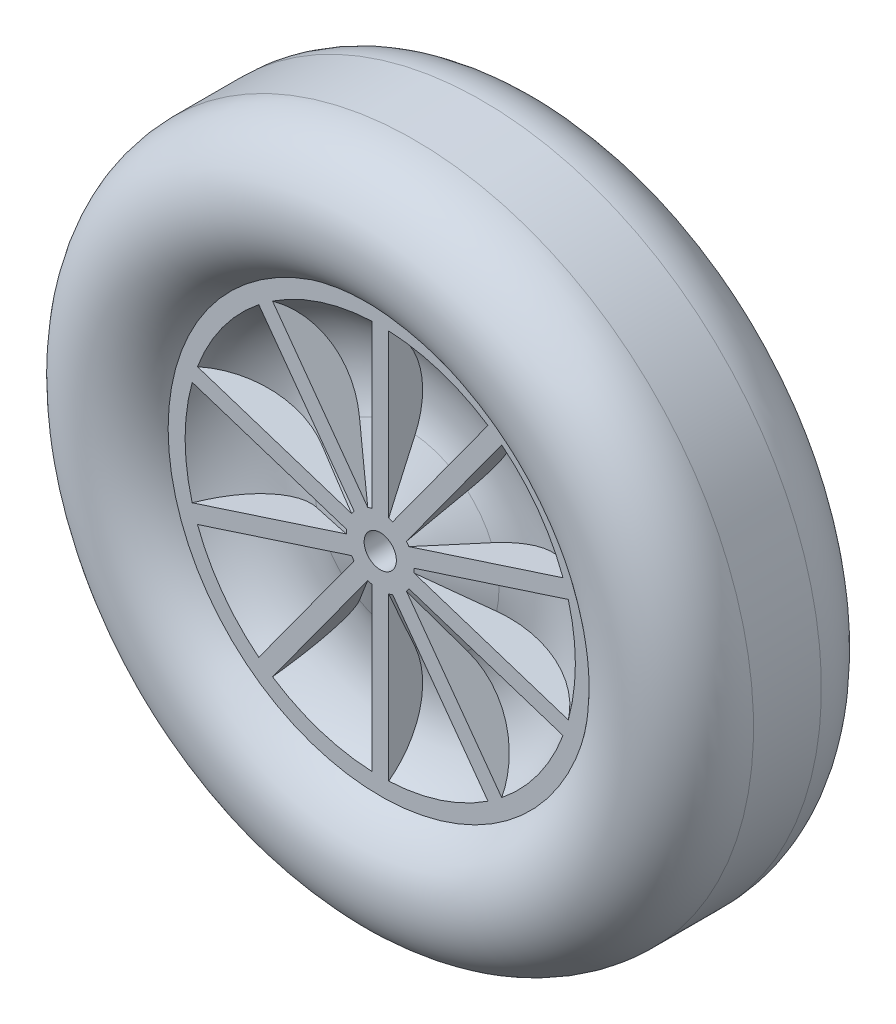
from build123d import *

# Parameters (mm, degrees)
SKETCH8_W           = 10
SKETCH8_H           = 120
BOSS_EXTRUDE1_DEPTH = 40
CIRPATTERN1_COUNT   = 10
SKETCH9_R           = 9.5
CUT_EXTRUDE1_DEPTH  = 301.055596734


with BuildPart() as part:
    # Sketch5 → Revolve1 (revolve)
    with BuildSketch(Plane(origin=(0, 0, 0), x_dir=(0, 0, -1), z_dir=(1, 0, 0)), mode=Mode.PRIVATE) as revolve1_sk:
        with BuildLine():
            Line((-40, 0), (-40, 20))
            Line((-40, 20), (-24.443255163, 54.394588093))
            ThreePointArc((-24.443255163, 54.394588093), (-21.570056673, 87.431435529), (-40, 115))
            Line((-40, 115), (-40, 125))
            Line((-40, 125), (40, 125))
            Line((40, 125), (40, 115))
            ThreePointArc((40, 115), (21.570056673, 87.431435529), (24.443255163, 54.394588093))
            Line((24.443255163, 54.394588093), (40, 20))
            Line((40, 20), (40, 0))
            Line((40, 0), (-40, 0))
        make_face()
    revolve(revolve1_sk.sketch.rotate(Axis((0, 0, -66.183333333), (0, 0, 1)), 90), axis=Axis((0, 0, -66.183333333), (0, 0, 1)))

    # Sketch8 → Boss-Extrude1 (add, symmetric)
    with BuildSketch(Plane.XY):
        with Locations((0, 60)):
            Rectangle(SKETCH8_W, SKETCH8_H)
    boss_extrude1 = extrude(amount=BOSS_EXTRUDE1_DEPTH, both=True)

    # CirPattern1: Boss-Extrude1 ×10 about axis
    cirpattern1_axis = Axis((0, 0, 0), (0, 0, 1))
    for i in range(1, CIRPATTERN1_COUNT):
        add(boss_extrude1.rotate(cirpattern1_axis, i * 360 / CIRPATTERN1_COUNT))

    # Sketch7 → Revolve2 (revolve)
    with BuildSketch(Plane(origin=(0, 0, 0), x_dir=(0, 0, -1), z_dir=(1, 0, 0)), mode=Mode.PRIVATE) as revolve2_sk:
        with BuildLine():
            Line((-40, 125), (40, 125))
            ThreePointArc((40, 125), (58.810436741, 170.182783131), (20, 200))
            Line((20, 200), (-20, 200))
            ThreePointArc((-20, 200), (-58.810436741, 170.182783131), (-40, 125))
        make_face()
    revolve(revolve2_sk.sketch.rotate(Axis((0, 0, -66.183333333), (0, 0, 1)), 90), axis=Axis((0, 0, -66.183333333), (0, 0, 1)))

    # Sketch9 → Cut-Extrude1 (cut, through all)
    with BuildSketch(Plane.XY.offset(40)):
        Circle(SKETCH9_R)
    extrude(amount=-CUT_EXTRUDE1_DEPTH, mode=Mode.SUBTRACT)


solid = part.part
